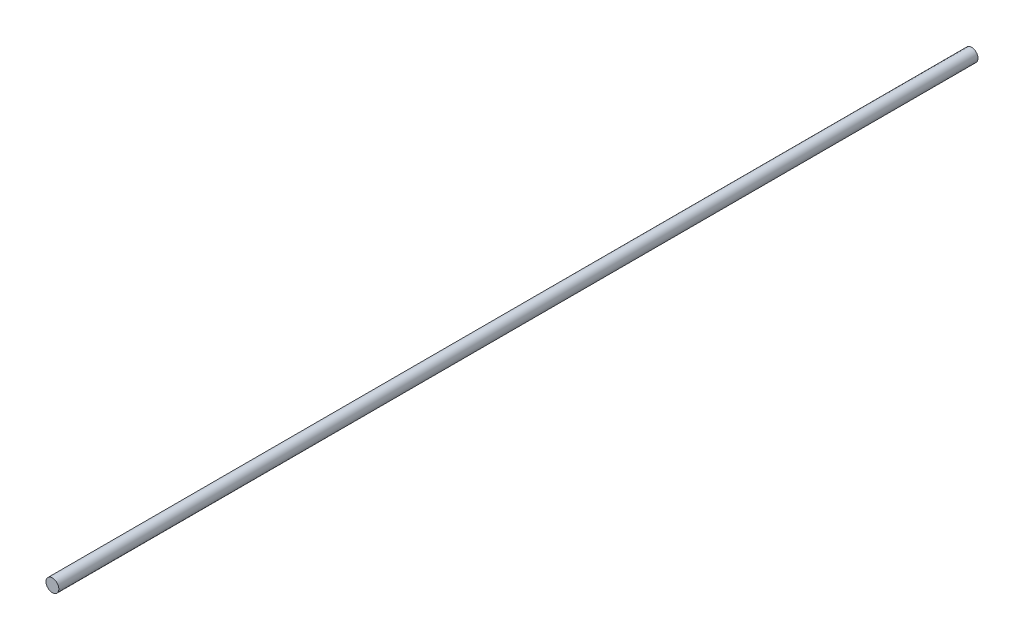
from build123d import *

# Parameters (mm, degrees)
SKETCH1_R           = 1.5
BOSS_EXTRUDE2_DEPTH = 215


with BuildPart() as part:
    # Sketch1 → Boss-Extrude2 (new body)
    with BuildSketch(Plane.XY):
        with Locations((-2.99287928, 0.051942023)):
            Circle(SKETCH1_R)
    extrude(amount=BOSS_EXTRUDE2_DEPTH)


solid = part.part
